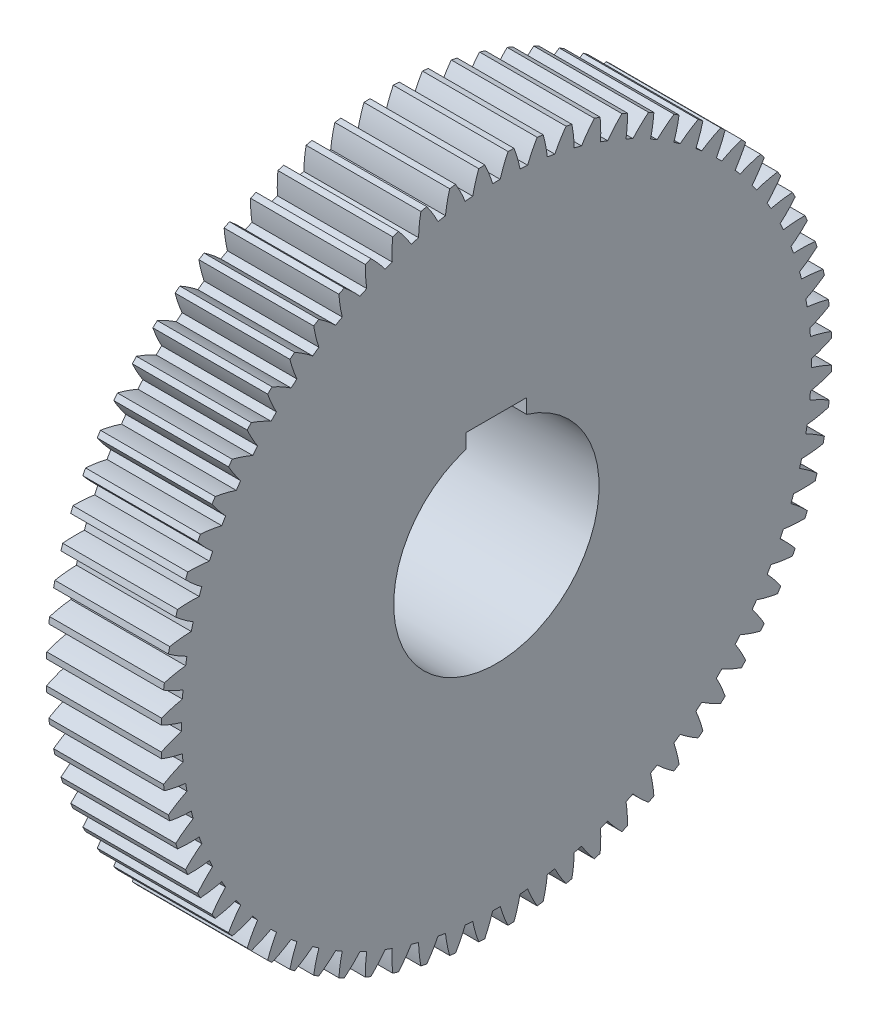
from build123d import *

# Parameters (mm, degrees)
BASPROSKE_W      = 38
BASPROSKE_H      = 111
TOOTHCUT_DEPTH   = 162.51160949
TEETHCUTS_COUNT  = 72
HUBNEAONESKE_R   = 42.5
HUBNEARONE_DEPTH = 24.0000508
BORSKE_R         = 34
BORE_DEPTH       = 62.0000508
KEYSKE_W         = 20
KEYSKE_H         = 37.3
KEYWAY_DEPTH     = 62.0000508


with BuildPart() as part:
    # BasProSke → Base-Revolve (revolve)
    with BuildSketch(Plane(origin=(0, 0, 0), x_dir=(1, 0, 0), z_dir=(0, 1, 0)), mode=Mode.PRIVATE) as base_revolve_sk:
        with Locations((19, 55.5)):
            Rectangle(BASPROSKE_W, BASPROSKE_H)
    revolve(base_revolve_sk.sketch.rotate(Axis((-10, 0, 0), (1, 0, 0)), 180), axis=Axis((-10, 0, 0), (1, 0, 0)))

    # TooCutSke → ToothCut (cut, through all)
    with BuildSketch(Plane(origin=(0, 0, 0), x_dir=(0, 0, -1), z_dir=(1, 0, 0))):
        with BuildLine():
            ThreePointArc((1.260102081, 104.241384026), (0, 104.249), (-1.260102081, 104.241384026))
            ThreePointArc((-1.260102081, 104.241384026), (-2.419555529, 107.654106549), (-3.859459153, 110.958298564))
            ThreePointArc((-3.859459153, 110.958298564), (0, 111.0254), (3.859459153, 110.958298564))
            ThreePointArc((3.859459153, 110.958298564), (2.419555529, 107.654106549), (1.260102081, 104.241384026))
        make_face()
    toothcut = extrude(amount=TOOTHCUT_DEPTH, mode=Mode.SUBTRACT)

    # TeethCuts: ToothCut ×72 about axis
    teethcuts_axis = Axis((0, 0, 0), (1, 0, 0))
    for i in range(1, TEETHCUTS_COUNT):
        add(toothcut.rotate(teethcuts_axis, i * 360 / TEETHCUTS_COUNT), mode=Mode.SUBTRACT)

    # HubNeaOneSke → HubNearOne (add)
    with BuildSketch(Plane.ZY):
        with Locations(Location((0, 0, 0), (0, 0, 180))):
            Circle(HUBNEAONESKE_R)
    extrude(amount=HUBNEARONE_DEPTH)

    # BorSke → Bore (cut, symmetric)
    with BuildSketch(Plane(origin=(0, 0, 0), x_dir=(0, 0, -1), z_dir=(1, 0, 0))):
        with Locations(Location((0, 0, 0), (0, 0, 180))):
            Circle(BORSKE_R)
    extrude(amount=BORE_DEPTH, both=True, mode=Mode.SUBTRACT)

    # KeySke → Keyway (cut, symmetric)
    with BuildSketch(Plane(origin=(0, 0, 0), x_dir=(0, 0, -1), z_dir=(1, 0, 0))):
        with Locations((0, 18.65)):
            Rectangle(KEYSKE_W, KEYSKE_H)
    extrude(amount=KEYWAY_DEPTH, both=True, mode=Mode.SUBTRACT)


solid = part.part
